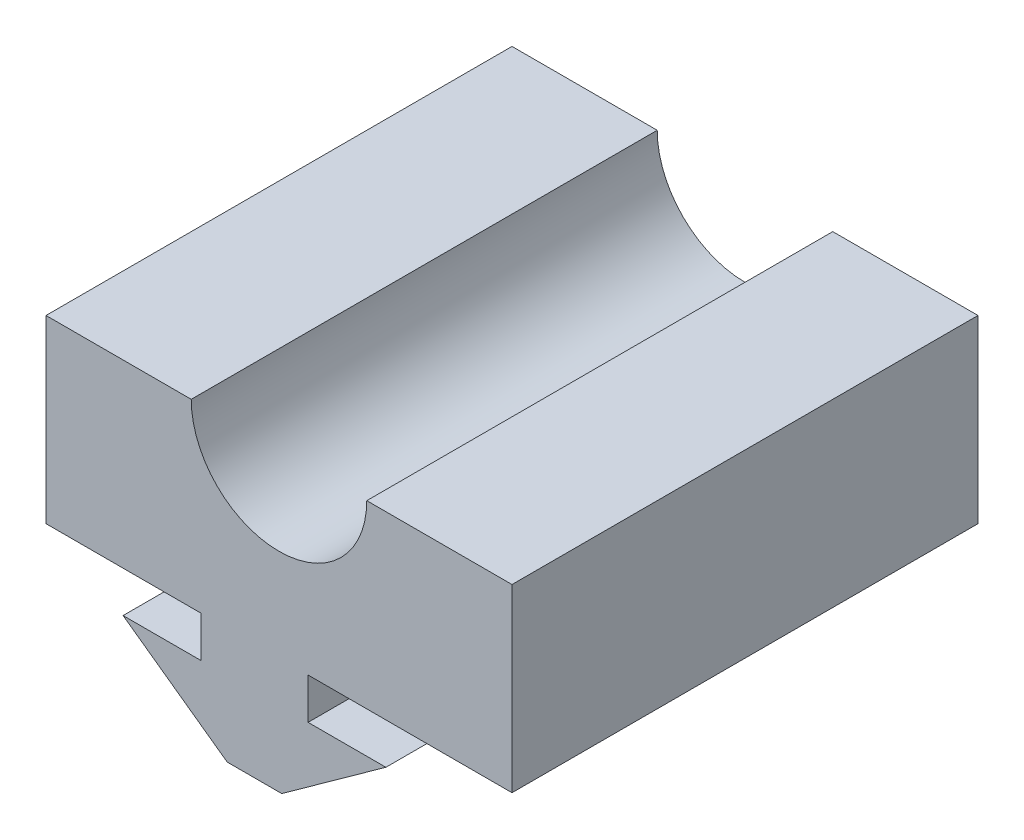
from build123d import *

# Parameters (mm, degrees)
BOSS_EXTRUDE1_DEPTH = 25.4


with BuildPart() as part:
    # Sketch1 → Boss-Extrude1 (new body)
    with BuildSketch(Plane.XY):
        with BuildLine():
            Line((0, 0), (8.443048692, 0))
            Line((8.443048692, 0), (8.443048692, -2.2352))
            Line((8.443048692, -2.2352), (4.201248692, -2.2352))
            Line((4.201248692, -2.2352), (9.878148692, -6.315260883))
            Line((9.878148692, -6.315260883), (12.849948692, -6.315260883))
            Line((12.849948692, -6.315260883), (18.526848692, -2.2352))
            Line((18.526848692, -2.2352), (14.285048692, -2.2352))
            Line((14.285048692, -2.2352), (14.285048692, 0))
            Line((14.285048692, 0), (25.4, 0))
            Line((25.4, 0), (25.4, 9.829452055))
            Line((25.4, 9.829452055), (17.484246575, 9.829452055))
            ThreePointArc((17.484246575, 9.829452055), (12.7, 5.045205479), (7.915753425, 9.829452055))
            Line((7.915753425, 9.829452055), (0, 9.829452055))
            Line((0, 9.829452055), (0, 0))
        make_face()
    extrude(amount=BOSS_EXTRUDE1_DEPTH)


solid = part.part
